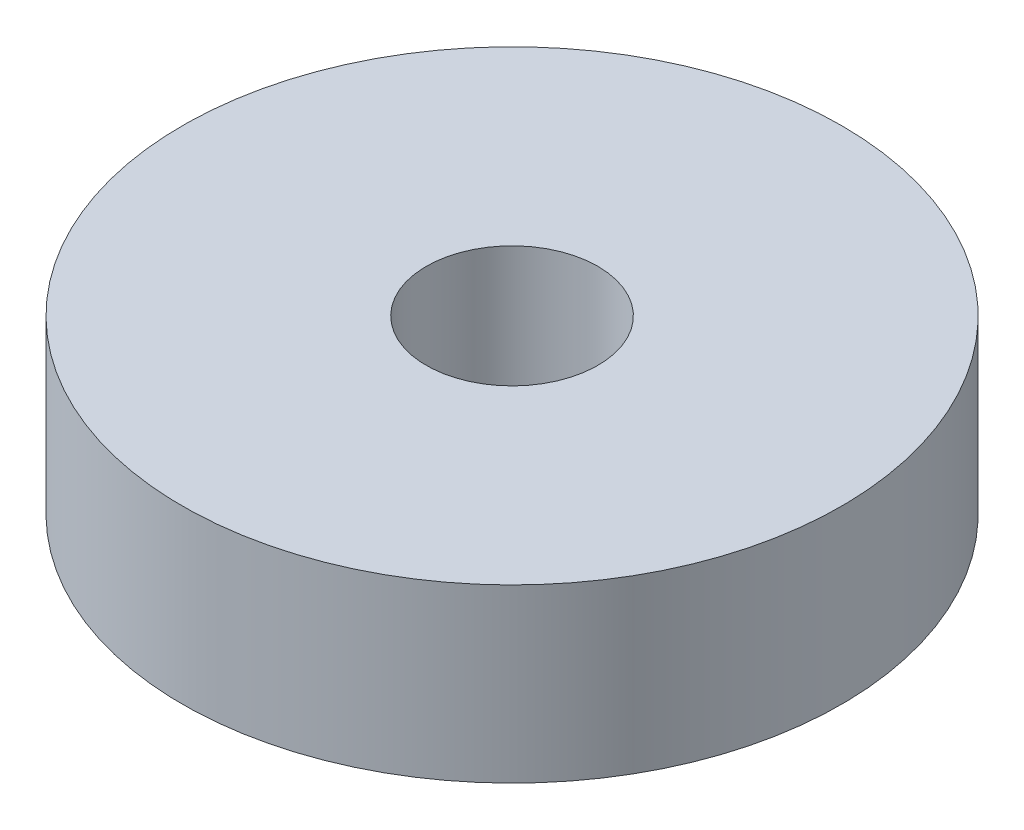
from build123d import *

# Parameters (mm, degrees)
SKETCH1_W = 4.5085
SKETCH1_H = 3.175


with BuildPart() as part:
    # Sketch1 → Revolve1 (revolve)
    with BuildSketch(Plane.XY, mode=Mode.PRIVATE) as revolve1_sk:
        with Locations((3.84175, 0)):
            Rectangle(SKETCH1_W, SKETCH1_H)
    revolve(revolve1_sk.sketch.rotate(Axis((0, 0, 0), (0, 1, 0)), 90), axis=Axis((0, 0, 0), (0, 1, 0)))


solid = part.part
